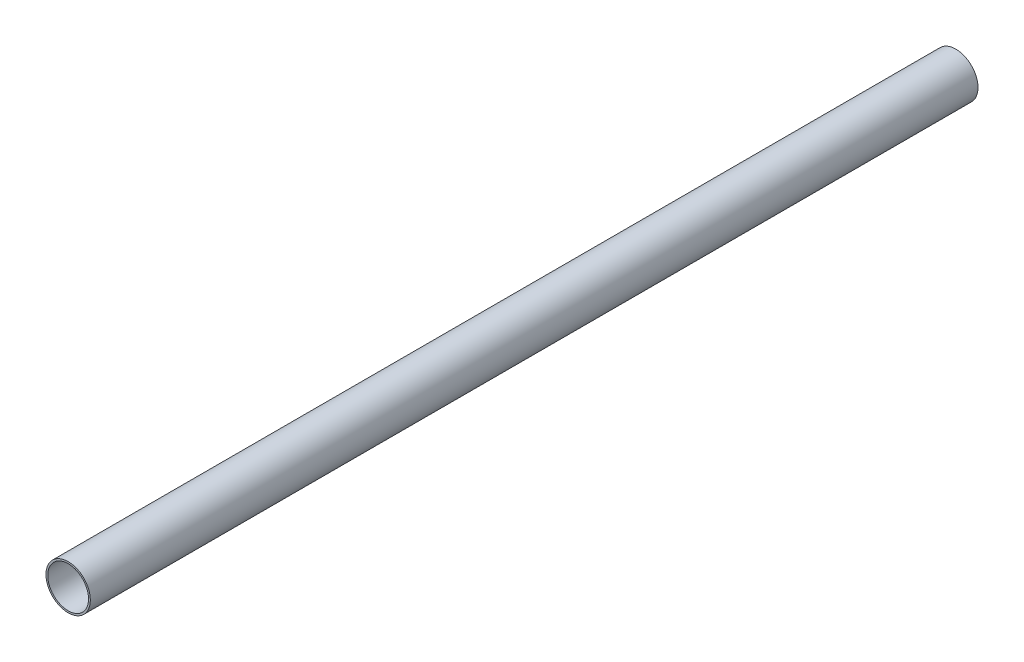
from build123d import *

# Parameters (mm, degrees)
SKETCH1_R           = 12.5
SKETCH1_R_2         = 11.5
BOSS_EXTRUDE1_DEPTH = 250


with BuildPart() as part:
    # Sketch1 → Boss-Extrude1 (new, symmetric)
    with BuildSketch(Plane.XY):
        Circle(SKETCH1_R)
        Circle(SKETCH1_R_2, mode=Mode.SUBTRACT)
    extrude(amount=BOSS_EXTRUDE1_DEPTH, both=True)


solid = part.part
